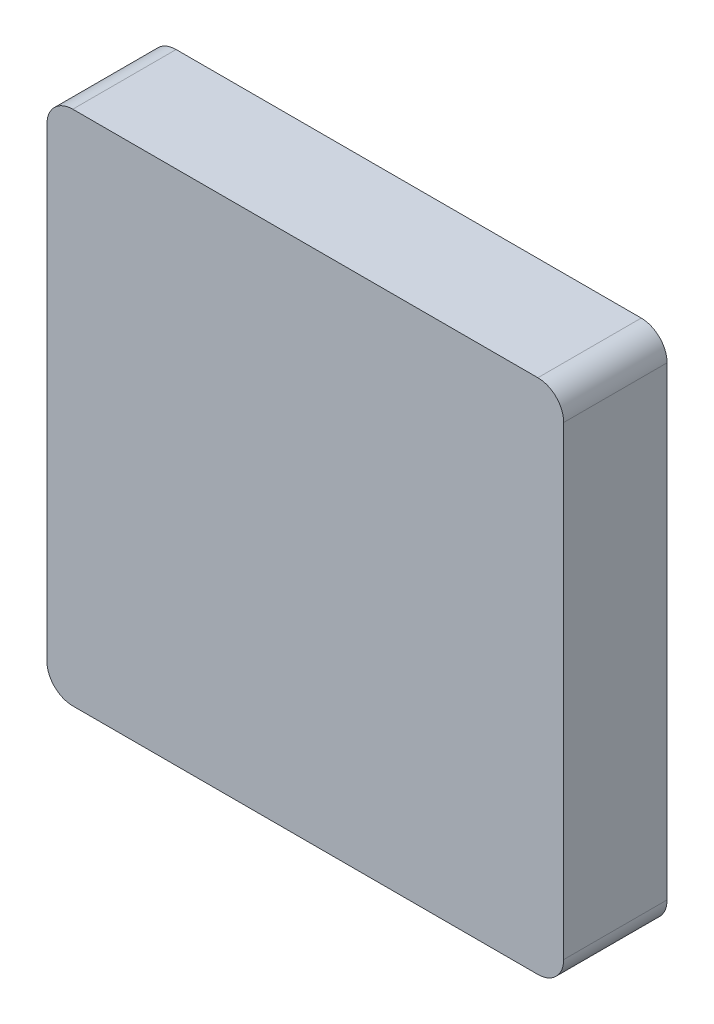
from build123d import *

# Parameters (mm, degrees)
SKETCH1_W           = 100
SKETCH1_H           = 100
BOSS_EXTRUDE1_DEPTH = 20
FILLET1_R           = 5


with BuildPart() as part:
    # Sketch1 → Boss-Extrude1 (new body)
    with BuildSketch(Plane.XY):
        with Locations((50, 50)):
            Rectangle(SKETCH1_W, SKETCH1_H)
    extrude(amount=BOSS_EXTRUDE1_DEPTH)

    # Fillet1
    fillet1_edges = [part.edges().sort_by_distance(p)[0] for p in [
        (0, 100, 10),
        (100, 100, 10),
        (100, 0, 10),
        (0, 0, 10),
    ]]
    fillet(fillet1_edges, radius=FILLET1_R)


solid = part.part
